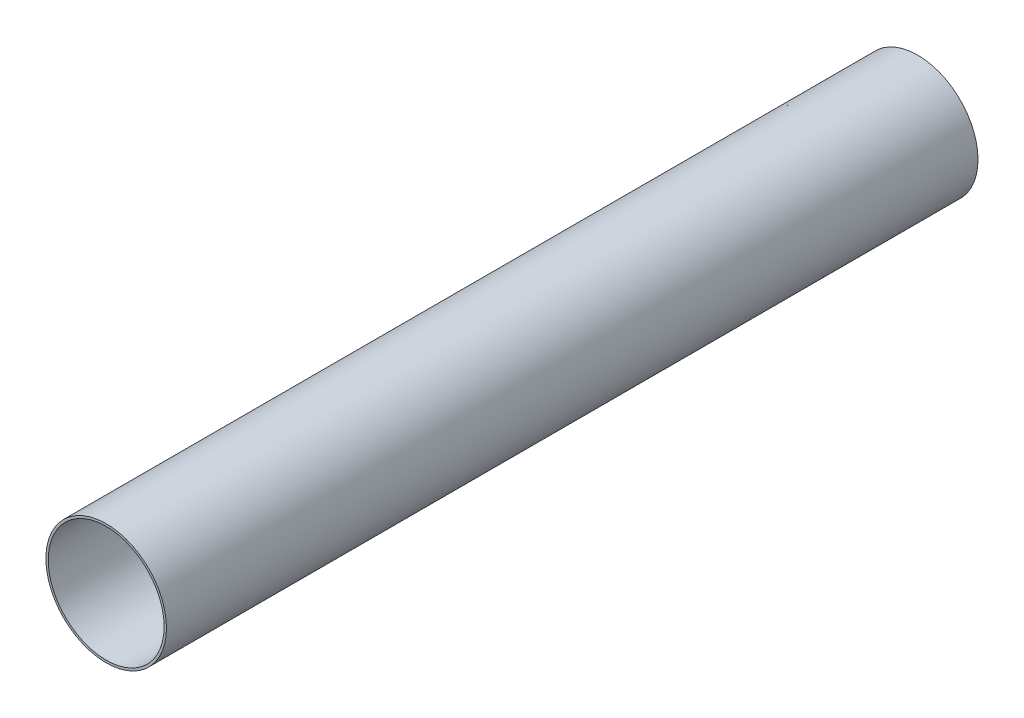
from build123d import *

# Parameters (mm, degrees)
SKETCH1_R           = 78
SKETCH1_R_2         = 75
BOSS_EXTRUDE1_DEPTH = 1050


with BuildPart() as part:
    # Sketch1 → Boss-Extrude1 (new body)
    with BuildSketch(Plane.XY):
        Circle(SKETCH1_R)
        Circle(SKETCH1_R_2, mode=Mode.SUBTRACT)
    extrude(amount=-BOSS_EXTRUDE1_DEPTH)


solid = part.part
